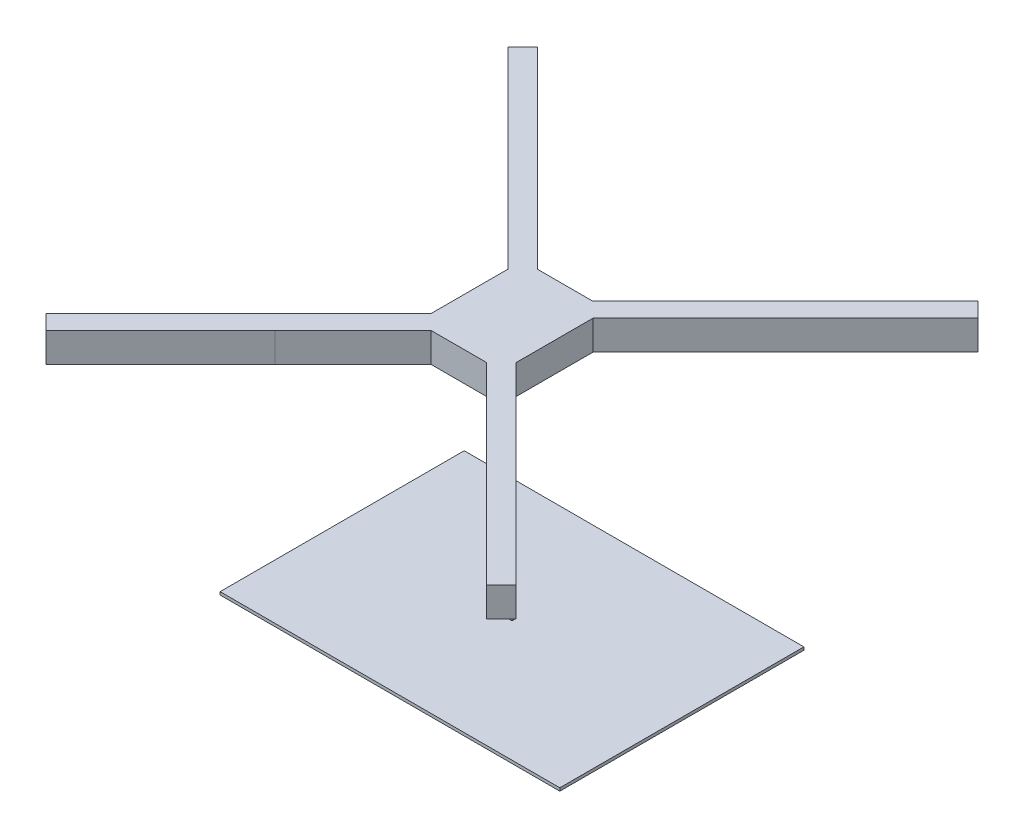
from build123d import *

# Parameters (mm, degrees)
BOSS_EXTRUDE1_DEPTH = 40
SKETCH2_R           = 2
BOSS_EXTRUDE2_DEPTH = 317
SKETCH3_W           = 461.580426742
SKETCH3_H           = 331.625976184
BOSS_EXTRUDE3_DEPTH = 4


with BuildPart() as part:
    # Sketch1 → Boss-Extrude1 (new body)
    with BuildSketch(Plane(origin=(0, 0, 0), x_dir=(1, 0, 0), z_dir=(0, 1, 0))):
        Polygon((-37.739281915, 72.174102179), (-143.805299093, 178.240119357), (-299.368790954, 333.803611218), (-319.365770726, 313.806631446), (-163.802279668, 158.243140388), (-57.739282705, 52.174103081), (-57.739282705, -52.174103272), (-163.80227984, -158.243140407), (-319.361342305, -313.811061538), (-299.36379317, -333.807471931), (-143.805300025, -178.240120135), (-37.739282847, -72.174102957), (37.739282893, -72.174102957), (143.805300071, -178.240120135), (299.368791932, -333.803611997), (319.365771704, -313.806632225), (163.802280352, -158.243140872), (57.739283379, -52.174103575), (57.739283379, 52.174102471), (163.802280509, 158.243139611), (319.361342965, 313.811060751), (299.36379383, 333.807471143), (143.805300678, 178.240119357), (37.7392835, 72.174102179), align=None)
    extrude(amount=BOSS_EXTRUDE1_DEPTH)

    # Sketch2 → Boss-Extrude2 (add)
    with BuildSketch(Plane(origin=(0, 0, 0), x_dir=(-1, 0, 0), z_dir=(0, -1, 0))):
        with Locations(Location((0, 0, 0), (0, 0, 90))):
            Circle(SKETCH2_R)
    extrude(amount=BOSS_EXTRUDE2_DEPTH)

    # Sketch3 → Boss-Extrude3 (add)
    with BuildSketch(Plane.XZ.offset(317)):
        Rectangle(SKETCH3_W, SKETCH3_H)
    extrude(amount=BOSS_EXTRUDE3_DEPTH)


solid = part.part
